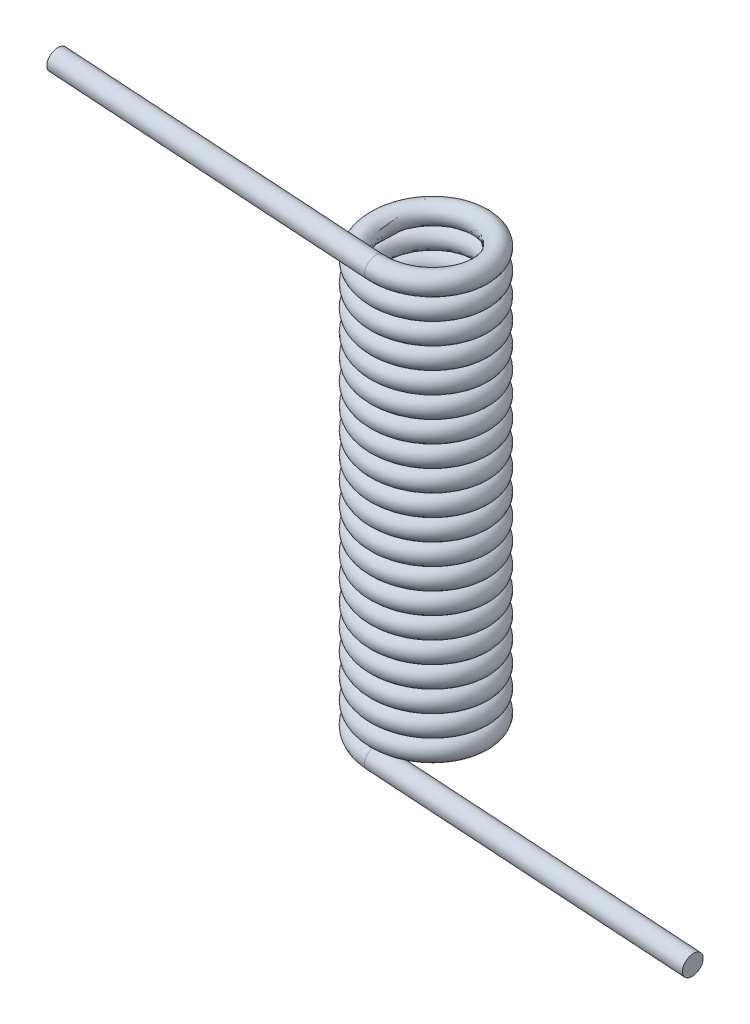
from build123d import *

# Parameters (mm, degrees)
SWEEP3_PITCH        = 1.27
SWEEP3_HEIGHT       = 25.4
SWEEP3_RADIUS       = 3.048
SWEEP3_PROFILE_R    = 0.6223
SKETCH35_R          = 0.6223
BOSS_EXTRUDE1_DEPTH = 19.05
SKETCH36_R          = 0.6223
BOSS_EXTRUDE2_DEPTH = 19.05


with BuildPart() as part:
    # Sweep3: sweep along a helix
    with BuildLine() as sweep3_path:
        Helix(SWEEP3_PITCH, SWEEP3_HEIGHT, SWEEP3_RADIUS, center=(0, -13.97, 0), direction=(0, 1, 0), lefthand=True)
    # Sweep3 profile (on start of the path) → Sweep3 (sweep)
    with BuildSketch(Plane(origin=(0, -13.97, 3.048), x_dir=(-0.06616922564165009, -0.9978084152671717, 0), z_dir=(-0.9978084152671717, 0.06616922564165009, -2.4481941312147e-13))):
        Circle(SWEEP3_PROFILE_R)
    sweep(path=sweep3_path.line, is_frenet=True)

    # Sketch35 → Boss-Extrude1 (add)
    with BuildSketch(Plane(origin=(-0.754656722, 0.050044728, 0), x_dir=(0, 0, 1), z_dir=(-0.9978084152669378, 0.06616922564517673, 0))):
        with Locations(Location((3.048, 11.404950187, 0), (0, 0, 270))):
            Circle(SKETCH35_R)
    extrude(amount=BOSS_EXTRUDE1_DEPTH)

    # Sketch36 → Boss-Extrude2 (add)
    with BuildSketch(Plane(origin=(0.922358216, -0.061165779, 0), x_dir=(0, 0, -1), z_dir=(0.9978084152669378, -0.0661692256451768, 0))):
        with Locations(Location((-3.048, -13.939383561, 0), (0, 0, 270))):
            Circle(SKETCH36_R)
    extrude(amount=BOSS_EXTRUDE2_DEPTH)


solid = part.part
